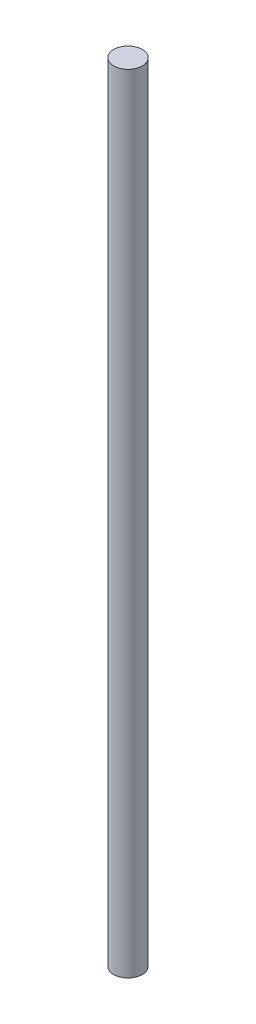
from build123d import *

# Parameters (mm, degrees)
SKETCH1_R           = 0.3
BOSS_EXTRUDE1_DEPTH = 16.5


with BuildPart() as part:
    # Sketch1 → Boss-Extrude1 (new body)
    with BuildSketch(Plane(origin=(0, 0, 0), x_dir=(1, 0, 0), z_dir=(0, 1, 0))):
        with Locations(Location((0, 0, 0), (0, 0, 270))):
            Circle(SKETCH1_R)
    extrude(amount=BOSS_EXTRUDE1_DEPTH)


solid = part.part
